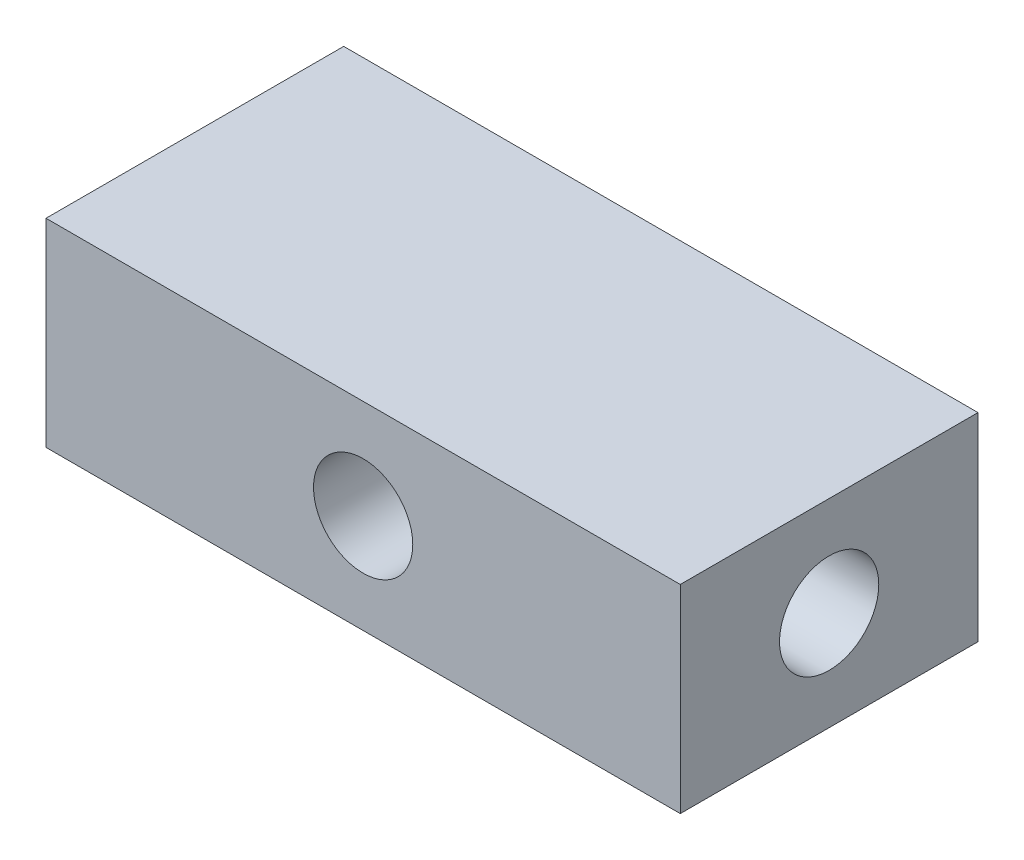
from build123d import *

# Parameters (mm, degrees)
SCHIZZO1_W                   = 31.958658916
SCHIZZO1_H                   = 15
ESTRUSIONE_ESTRUSIONE1_DEPTH = 10
SCHIZZO4_R                   = 2.5
TAGLIO_ESTRUSIONE1_DEPTH     = 25.103941586
SCHIZZO5_R                   = 2.5
TAGLIO_ESTRUSIONE2_DEPTH     = 37.692722435


with BuildPart() as part:
    # Schizzo1 → Estrusione-Estrusione1 (new body)
    with BuildSketch(Plane(origin=(0, 0, 0), x_dir=(1, 0, 0), z_dir=(0, 1, 0))):
        with Locations((-0.020670542, 7.5)):
            Rectangle(SCHIZZO1_W, SCHIZZO1_H)
    extrude(amount=-ESTRUSIONE_ESTRUSIONE1_DEPTH)

    # Schizzo4 → Taglio-Estrusione1 (cut, through all)
    with BuildSketch(Plane.XY):
        with Locations((-0.020670542, -5)):
            Circle(SCHIZZO4_R)
    extrude(amount=-TAGLIO_ESTRUSIONE1_DEPTH, mode=Mode.SUBTRACT)

    # Schizzo5 → Taglio-Estrusione2 (cut, through all)
    with BuildSketch(Plane(origin=(15.958658916, 0, 0), x_dir=(0, 0, -1), z_dir=(1, 0, 0))):
        with Locations((7.5, -5)):
            Circle(SCHIZZO5_R)
    extrude(amount=-TAGLIO_ESTRUSIONE2_DEPTH, mode=Mode.SUBTRACT)


solid = part.part
